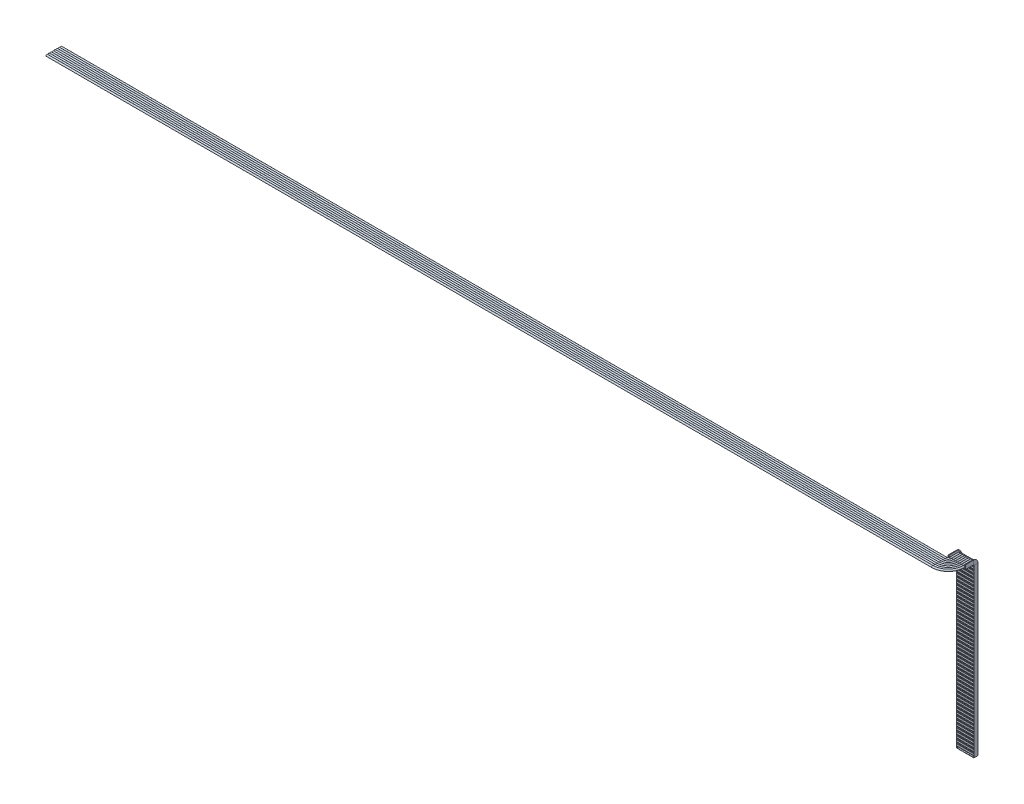
from build123d import *

# Parameters (mm, degrees)
CROQUIS1_W              = 600
CROQUIS1_H              = 145
SALIENTE_EXTRUIR1_DEPTH = 10
CROQUIS3_W              = 560
CROQUIS3_H              = 59.024269605
CORTAR_EXTRUIR1_DEPTH   = 78
MATRIZL1_COUNT          = 50
MATRIZL1_PITCH          = 120
CROQUIS4_W              = 560
CROQUIS4_H              = 31.663817325
CORTAR_EXTRUIR2_DEPTH   = 78
MATRIZL2_COUNT          = 7
MATRIZL2_PITCH          = 50
CROQUIS5_R              = 30
CROQUIS6_R              = 30


with BuildPart() as part:
    # Croquis1 → Saliente-Extruir1 (new body)
    with BuildSketch(Plane(origin=(0, 0, 0), x_dir=(1, 0, 0), z_dir=(0, 1, 0))):
        Rectangle(CROQUIS1_W, CROQUIS1_H)
    extrude(amount=SALIENTE_EXTRUIR1_DEPTH)

    # Barrer1: sweep along a curve in space
    with BuildLine() as barrer1_path:
        Line((0, 0, 0), (0, 5826.5, 0))
        ThreePointArc((0, 5826.5, 0), (0, 5890.139610307, 26.360389693), (0, 5916.5, 90))
        Line((0, 5916.5, 90), (0, 5916.5, 367.5))
    # Croquis2 → Barrer1 (sweep)
    with BuildSketch(Plane(origin=(0, 10, 0), x_dir=(1, 0, 0), z_dir=(0, 1, 0))):
        Polygon((-300, 72.5), (-300, -72.5), (300, -72.5), (300, 72.5), (280, 72.5), (280, -47.5), (-280, -47.5), (-280, 72.5), align=None)
    sweep(path=barrer1_path.line)

    # Croquis3 → Cortar-Extruir1 (cut)
    with BuildSketch(Plane(origin=(0, 0, 47.5), x_dir=(-1, 0, 0), z_dir=(0, 0, -1))):
        with Locations((0, 39.512134803)):
            Rectangle(CROQUIS3_W, CROQUIS3_H)
    cortar_extruir1 = extrude(amount=-CORTAR_EXTRUIR1_DEPTH, mode=Mode.SUBTRACT)

    # MatrizL1: Cortar-Extruir1 ×50
    with Locations(*[(0, i * MATRIZL1_PITCH, 0) for i in range(1, MATRIZL1_COUNT)]):
        add(cortar_extruir1, mode=Mode.SUBTRACT)

    # Croquis4 → Cortar-Extruir2 (cut)
    with BuildSketch(Plane(origin=(0, 5869, 0), x_dir=(1, 0, 0), z_dir=(0, 1, 0))):
        with Locations((0, -105.831908663)):
            Rectangle(CROQUIS4_W, CROQUIS4_H)
    cortar_extruir2 = extrude(amount=-CORTAR_EXTRUIR2_DEPTH, mode=Mode.SUBTRACT)

    # MatrizL2: Cortar-Extruir2 ×7
    with Locations(*[(0, 0, i * MATRIZL2_PITCH) for i in range(1, MATRIZL2_COUNT)]):
        add(cortar_extruir2, mode=Mode.SUBTRACT)

    # Barrer2: sweep along a curve in space
    with BuildLine() as barrer2_path:
        Line((245.013284396, 10, 0), (245.013284396, 5856.98970305, 0))
        ThreePointArc((245.013284396, 5856.98970305, 0), (245.013284396, 5892.345042109, 14.644660941), (245.013284396, 5906.98970305, 50))
        Line((245.013284396, 5906.98970305, 50), (245.013284396, 5906.98970305, 244.509583619))
    # Croquis5 → Barrer2 (sweep)
    with BuildSketch(Plane(origin=(0, 10, 0), x_dir=(1, 0, 0), z_dir=(0, 1, 0))):
        with Locations((245.013284396, 0)):
            Circle(CROQUIS5_R)
        with Locations((175.013284396, 0)):
            Circle(CROQUIS5_R)
        with Locations((105.013284396, 0)):
            Circle(CROQUIS5_R)
        with Locations((35.013284396, 0)):
            Circle(CROQUIS5_R)
        with Locations((-34.986715604, 0)):
            Circle(CROQUIS5_R)
        with Locations((-104.986715604, 0)):
            Circle(CROQUIS5_R)
        with Locations((-174.986715604, 0)):
            Circle(CROQUIS5_R)
        with Locations((-244.986715604, 0)):
            Circle(CROQUIS5_R)
    sweep(path=barrer2_path.line)

    # Barrer10: sweep along a curve in space
    with BuildLine() as barrer10_path:
        Line((245.013284396, 5906.98970305, 244.509583619), (245.013284396, 5906.98970305, 363.509583619))
        ThreePointArc((245.013284396, 5906.98970305, 363.509583619), (83.922014049, 5906.98970305, 752.418313272), (-304.986715604, 5906.98970305, 913.509583619))
        Line((-304.986715604, 5906.98970305, 913.509583619), (-31235.276715604, 5906.98970305, 913.509583619))
    # Croquis6 → Barrer10 (sweep)
    with BuildSketch(Plane.XY.offset(244.509583619)):
        with Locations((245.013284396, 5906.98970305)):
            Circle(CROQUIS6_R)
        with Locations((175.013284396, 5906.98970305)):
            Circle(CROQUIS6_R)
        with Locations((105.013284396, 5906.98970305)):
            Circle(CROQUIS6_R)
        with Locations((35.013284396, 5906.98970305)):
            Circle(CROQUIS6_R)
        with Locations((-34.986715604, 5906.98970305)):
            Circle(CROQUIS6_R)
        with Locations((-104.986715604, 5906.98970305)):
            Circle(CROQUIS6_R)
        with Locations((-174.986715604, 5906.98970305)):
            Circle(CROQUIS6_R)
        with Locations((-244.986715604, 5906.98970305)):
            Circle(CROQUIS6_R)
    sweep(path=barrer10_path.line)


solid = part.part
